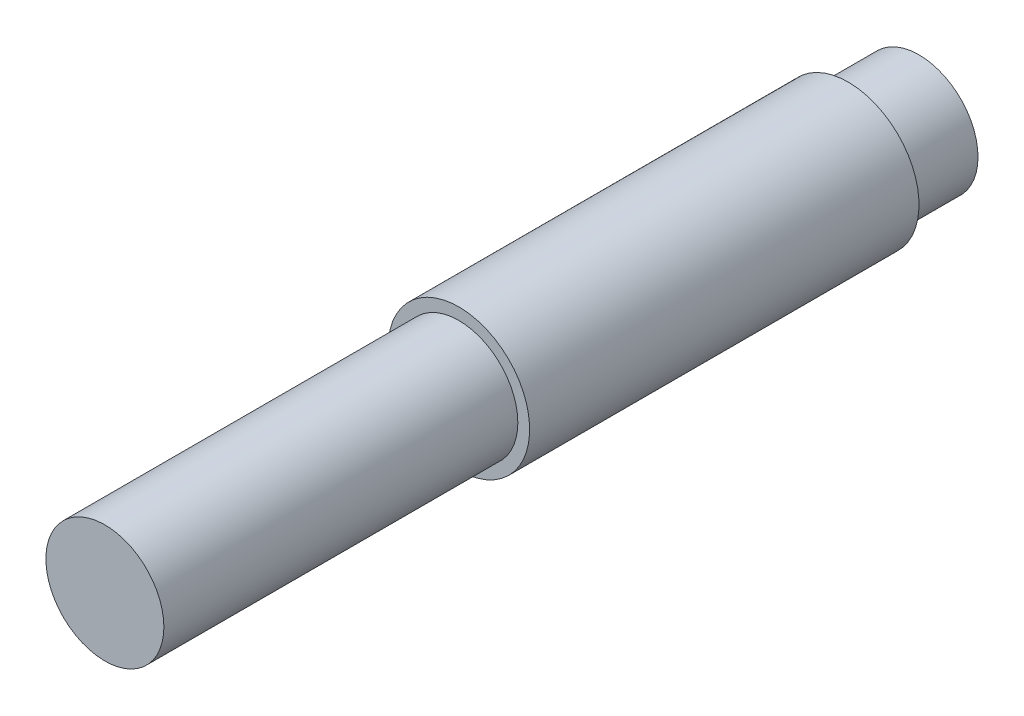
from build123d import *

# Parameters (mm, degrees)
SKETCH_1_R      = 2.5
SKETCH_1_R_2    = 1.410646597
EXTRUDE_1_DEPTH = 3
SKETCH_2_R      = 3
EXTRUDE_2_DEPTH = 16.5
EXTRUDE_START   = 15
SKETCH_3_R      = 2.5
EXTRUDE_3_DEPTH = 15


with BuildPart() as part:
    # Эскиз1 → Бобышка-Вытянуть1 (new body)
    with BuildSketch(Plane.XY):
        with Locations((0.280254447, 0.00265159)):
            Circle(SKETCH_1_R)
        with Locations((0.280254447, 0.00265159)):
            Circle(SKETCH_1_R_2, mode=Mode.SUBTRACT)
    extrude(amount=-EXTRUDE_1_DEPTH)

    # Эскиз2 → Бобышка-Вытянуть2 (add)
    with BuildSketch(Plane.XY):
        with Locations(Location((0.280254447, 0.00265159, 0), (0, 0, 180))):
            Circle(SKETCH_2_R)
    extrude(amount=EXTRUDE_2_DEPTH)

    # Эскиз3 → Бобышка-Вытянуть3 (add)
    with BuildSketch(Plane.XY.offset(16.5).offset(EXTRUDE_START)):
        with Locations((0.280254447, 0.00265159)):
            Circle(SKETCH_3_R)
    extrude(amount=-EXTRUDE_3_DEPTH)


solid = part.part
